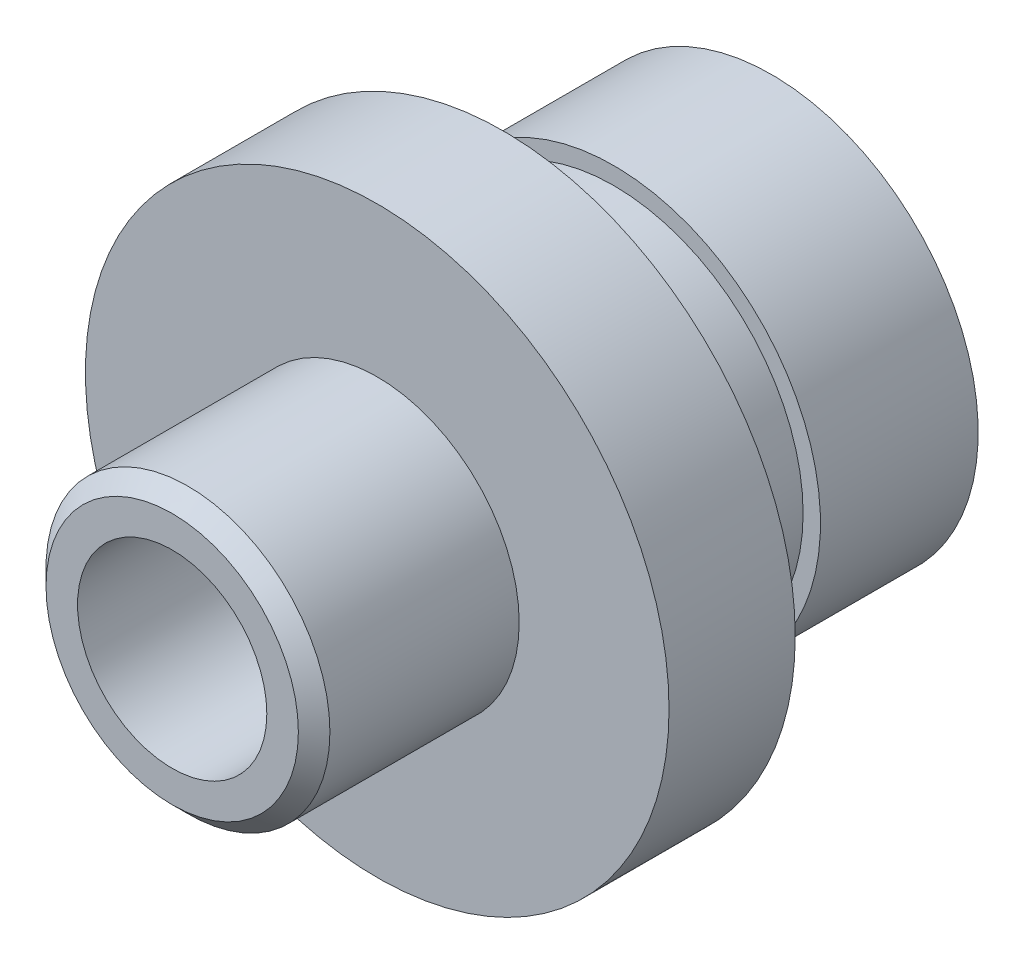
from build123d import *

# Parameters (mm, degrees)
SKETCH1_R           = 9.25
SKETCH1_R_2         = 3
BOSS_EXTRUDE1_DEPTH = 19
SKETCH2_OUTSIDE_W   = 26.966
SKETCH2_OUTSIDE_H   = 26.966
SKETCH2_OUTSIDE_R   = 4.5
CUT_EXTRUDE1_DEPTH  = 6.5
SKETCH3_OUTSIDE_W   = 26.966
SKETCH3_OUTSIDE_H   = 26.966
SKETCH3_OUTSIDE_R   = 6.8
CUT_EXTRUDE2_DEPTH  = 8.5
SKETCH4_OUTSIDE_W   = 26.966
SKETCH4_OUTSIDE_H   = 26.966
SKETCH4_OUTSIDE_R   = 6.55
CUT_EXTRUDE3_DEPTH  = 7
CHAMFER1_SIZE       = 0.5
CUT_EXTRUDE4_START  = -5
SKETCH5_OUTSIDE_W   = 26.966
SKETCH5_OUTSIDE_H   = 26.966
SKETCH5_OUTSIDE_R   = 6
CUT_EXTRUDE4_DEPTH  = 2


with BuildPart() as part:
    # Sketch1 → Boss-Extrude1 (new body)
    with BuildSketch(Plane.XY):
        Circle(SKETCH1_R)
        Circle(SKETCH1_R_2, mode=Mode.SUBTRACT)
    extrude(amount=BOSS_EXTRUDE1_DEPTH)

    # Sketch2 outside → Cut-Extrude1 (cut)
    with BuildSketch(Plane.XY.offset(19)):
        Rectangle(SKETCH2_OUTSIDE_W, SKETCH2_OUTSIDE_H)
        Circle(SKETCH2_OUTSIDE_R, mode=Mode.SUBTRACT)
    extrude(amount=-CUT_EXTRUDE1_DEPTH, mode=Mode.SUBTRACT)

    # Sketch3 outside → Cut-Extrude2 (cut)
    with BuildSketch(Plane(origin=(0, 0, 0), x_dir=(-1, 0, 0), z_dir=(0, 0, -1))):
        Rectangle(SKETCH3_OUTSIDE_W, SKETCH3_OUTSIDE_H)
        Circle(SKETCH3_OUTSIDE_R, mode=Mode.SUBTRACT)
    extrude(amount=-CUT_EXTRUDE2_DEPTH, mode=Mode.SUBTRACT)

    # Sketch4 outside → Cut-Extrude3 (cut)
    with BuildSketch(Plane(origin=(0, 0, 0), x_dir=(-1, 0, 0), z_dir=(0, 0, -1))):
        Rectangle(SKETCH4_OUTSIDE_W, SKETCH4_OUTSIDE_H)
        Circle(SKETCH4_OUTSIDE_R, mode=Mode.SUBTRACT)
    extrude(amount=-CUT_EXTRUDE3_DEPTH, mode=Mode.SUBTRACT)

    # Chamfer1
    chamfer1_edges = [part.edges().sort_by_distance(p)[0] for p in [
        (-4.5, 0, 19),
    ]]
    chamfer(chamfer1_edges, length=CHAMFER1_SIZE)

    # Sketch5 outside → Cut-Extrude4 (cut)
    with BuildSketch(Plane(origin=(0, 0, 0), x_dir=(-1, 0, 0), z_dir=(0, 0, -1)).offset(CUT_EXTRUDE4_START)):
        Rectangle(SKETCH5_OUTSIDE_W, SKETCH5_OUTSIDE_H)
        Circle(SKETCH5_OUTSIDE_R, mode=Mode.SUBTRACT)
    extrude(amount=-CUT_EXTRUDE4_DEPTH, mode=Mode.SUBTRACT)


solid = part.part
